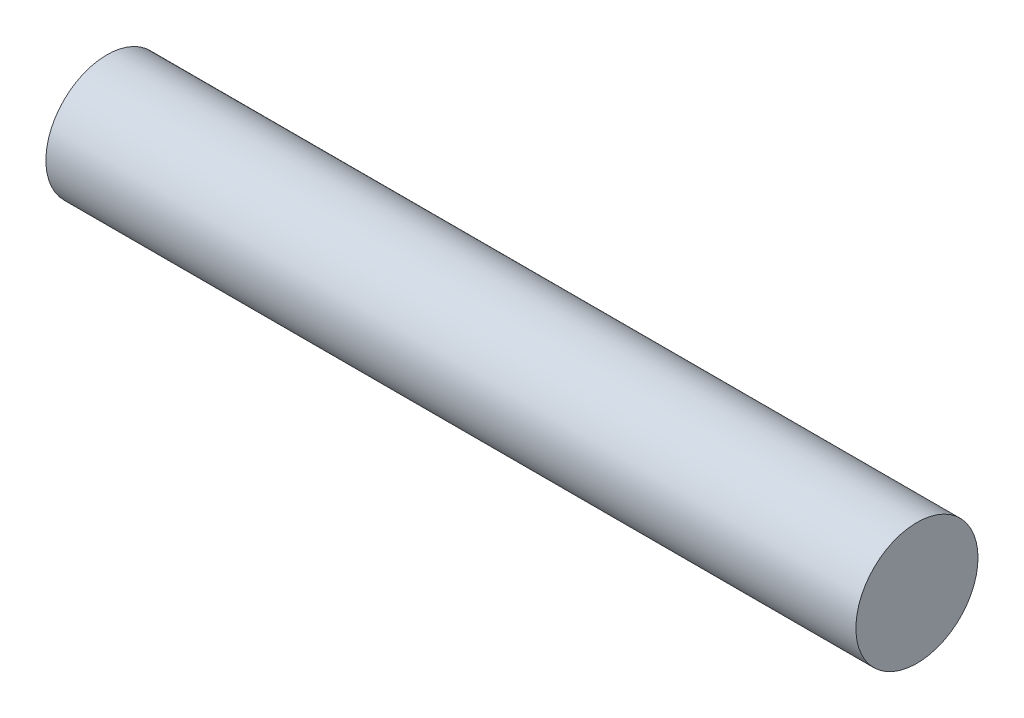
from build123d import *

# Parameters (mm, degrees)
CROQUIS1_W = 19.9
CROQUIS1_H = 1.5


with BuildPart() as part:
    # Croquis1 → Revolución1 (revolve)
    with BuildSketch(Plane.XY, mode=Mode.PRIVATE) as revoluci_n1_sk:
        with Locations((0.212397373, 0.75)):
            Rectangle(CROQUIS1_W, CROQUIS1_H)
    revolve(revoluci_n1_sk.sketch.rotate(Axis((10.946633826, 0, 0), (-1, 0, 0)), 90), axis=Axis((10.946633826, 0, 0), (-1, 0, 0)))


solid = part.part
